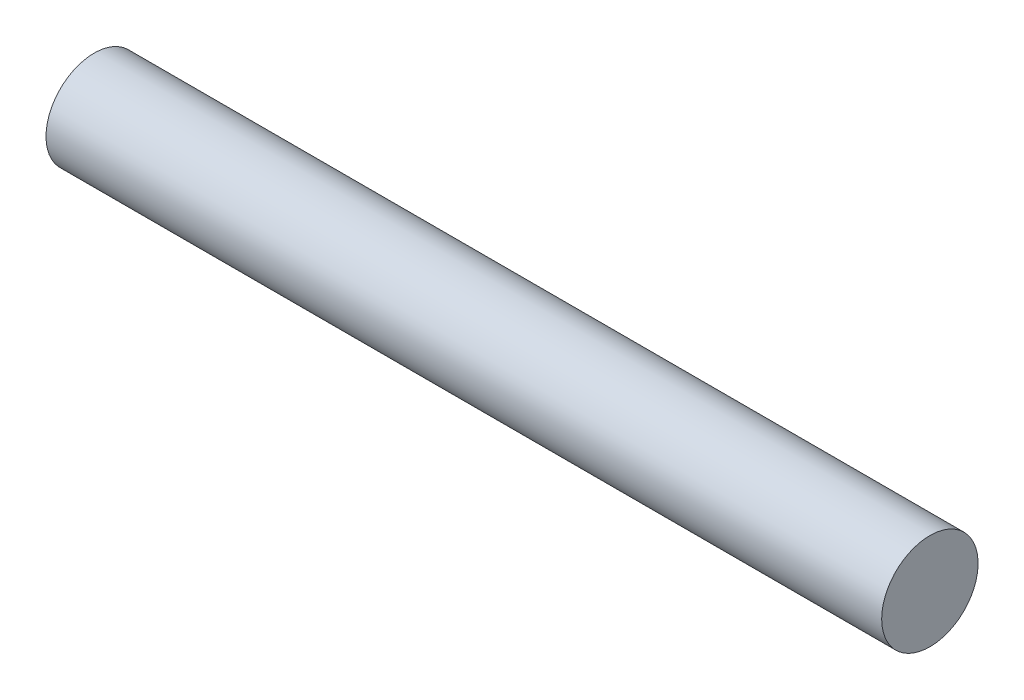
from build123d import *

# Parameters (mm, degrees)
SKETCH2_W = 26
SKETCH2_H = 1.5


with BuildPart() as part:
    # Sketch2 → Revolve2 (revolve)
    with BuildSketch(Plane.XY, mode=Mode.PRIVATE) as revolve2_sk:
        Rectangle(SKETCH2_W, SKETCH2_H)
    revolve(revolve2_sk.sketch.rotate(Axis((-13, -0.75, 0), (1, 0, 0)), 90), axis=Axis((-13, -0.75, 0), (1, 0, 0)))


solid = part.part
